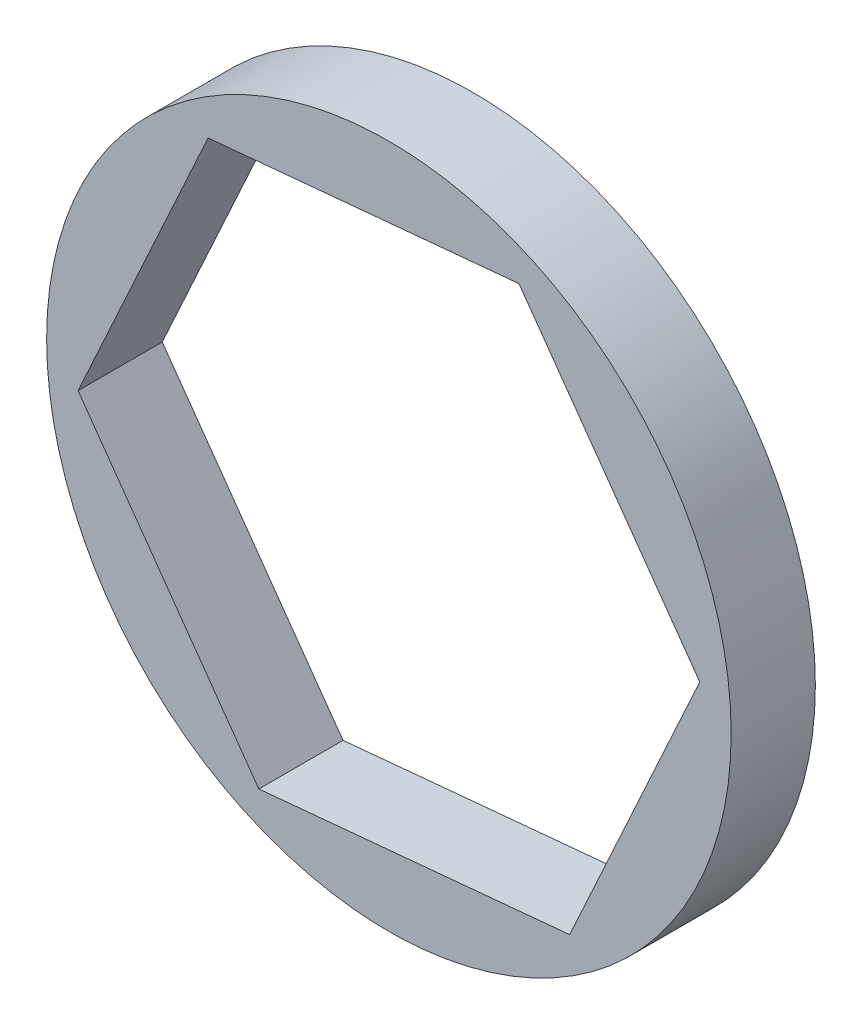
from build123d import *

# Parameters (mm, degrees)
SKETCH1_R           = 6.35
BOSS_EXTRUDE1_DEPTH = 1.5621


with BuildPart() as part:
    # Sketch1 → Boss-Extrude1 (new body)
    with BuildSketch(Plane.XY):
        Circle(SKETCH1_R)
        Polygon((-3.353892255, 4.722827869), (-5.767035039, -0.54314196), (-2.413142785, -5.265969828), (3.353892255, -4.722827869), (5.767035039, 0.54314196), (2.413142785, 5.265969828), align=None, mode=Mode.SUBTRACT)
    extrude(amount=BOSS_EXTRUDE1_DEPTH)


solid = part.part
